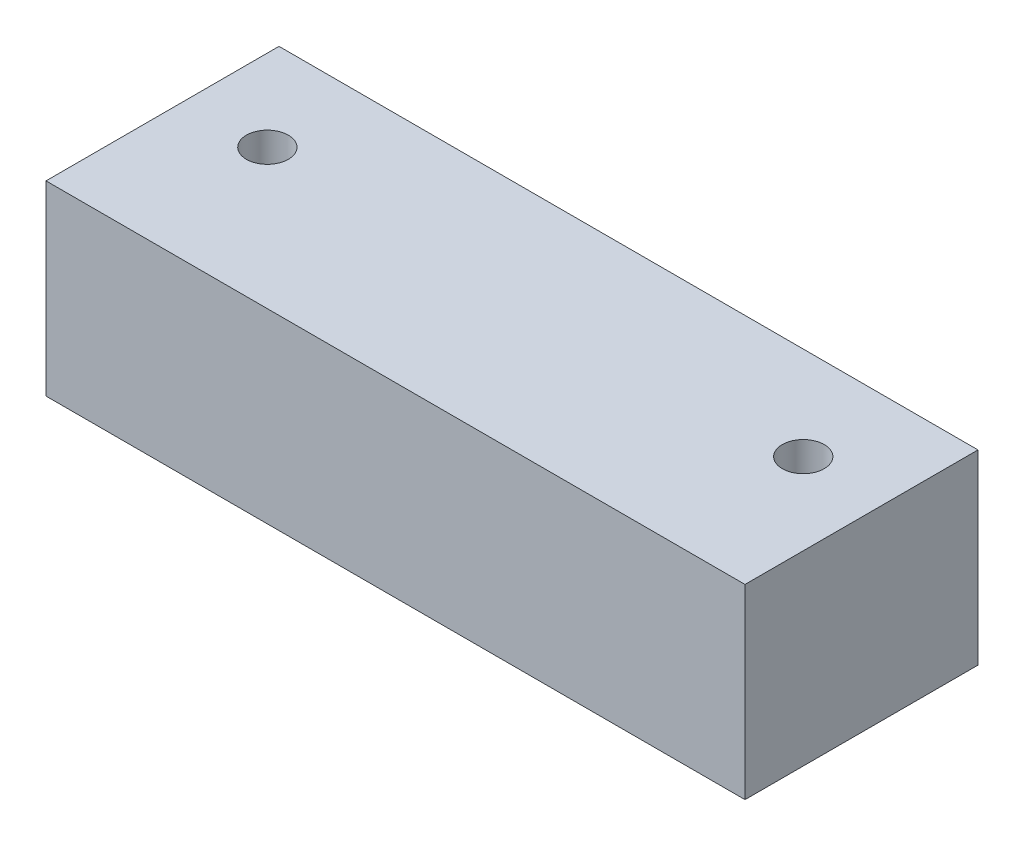
from build123d import *

# Parameters (mm, degrees)
SKETCH1_W               = 300
SKETCH1_H               = 80
BOSS_EXTRUDE1_DEPTH     = 50
CUT_EXTRUDE1_DEPTH      = 164.095064303
CUT_EXTRUDE1_DEPTH_BACK = 164.095064303
SKETCH2_R               = 9


with BuildPart() as part:
    # Sketch1 → Boss-Extrude1 (new, symmetric)
    with BuildSketch(Plane.XY):
        Rectangle(SKETCH1_W, SKETCH1_H)
    extrude(amount=BOSS_EXTRUDE1_DEPTH, both=True)

    # Sketch2 → Cut-Extrude1 (cut, two sides: drawn at the far end of the back side and taken through both)
    with BuildSketch(Plane(origin=(0, 0, 0), x_dir=(1, 0, 0), z_dir=(0, 1, 0)).offset(-CUT_EXTRUDE1_DEPTH_BACK)):
        with Locations(Location((-115, 10, 0), (0, 0, 270))):
            Circle(SKETCH2_R)
        with Locations(Location((115, 10, 0), (0, 0, 270))):
            Circle(SKETCH2_R)
    extrude(amount=CUT_EXTRUDE1_DEPTH + CUT_EXTRUDE1_DEPTH_BACK, mode=Mode.SUBTRACT)


solid = part.part
